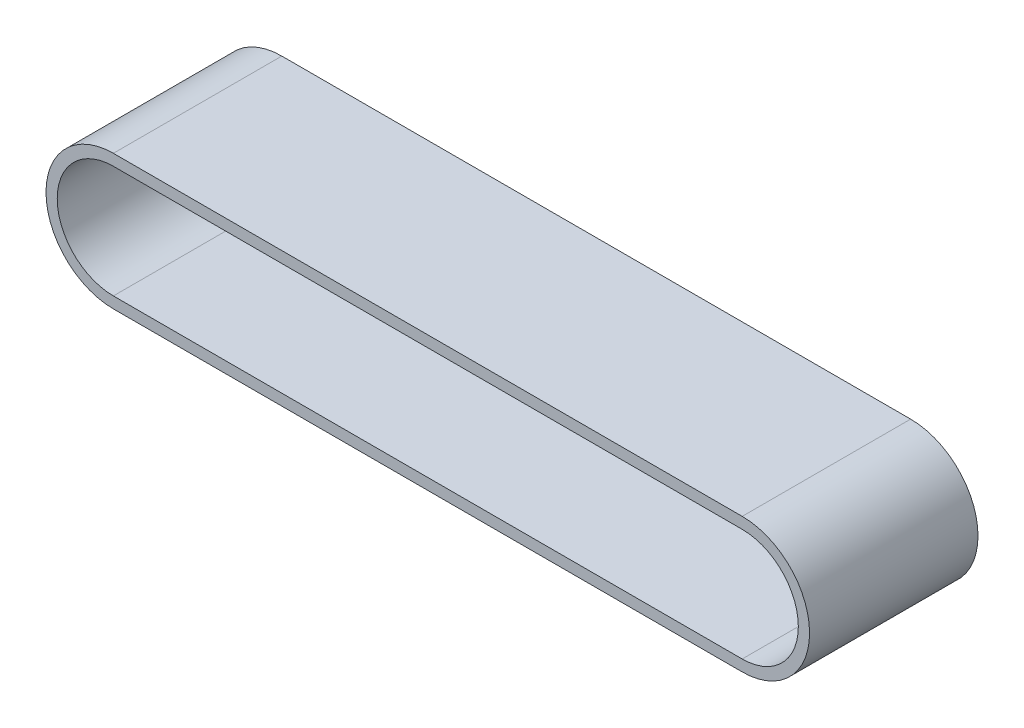
from build123d import *

# Parameters (mm, degrees)
BOSS_EXTRUDE1_DEPTH = 75


with BuildPart() as part:
    # Sketch1 → Boss-Extrude1 (new body)
    with BuildSketch(Plane.XY):
        with BuildLine():
            Line((0, 30), (280, 30))
            ThreePointArc((280, 30), (310, 0), (280, -30))
            Line((280, -30), (0, -30))
            ThreePointArc((0, -30), (-30, 0), (0, 30))
        make_face()
        with BuildLine():
            Line((0, 25), (280, 25))
            ThreePointArc((280, 25), (305, 0), (280, -25))
            Line((280, -25), (0, -25))
            ThreePointArc((0, -25), (-25, 0), (0, 25))
        make_face(mode=Mode.SUBTRACT)
    extrude(amount=BOSS_EXTRUDE1_DEPTH)


solid = part.part
